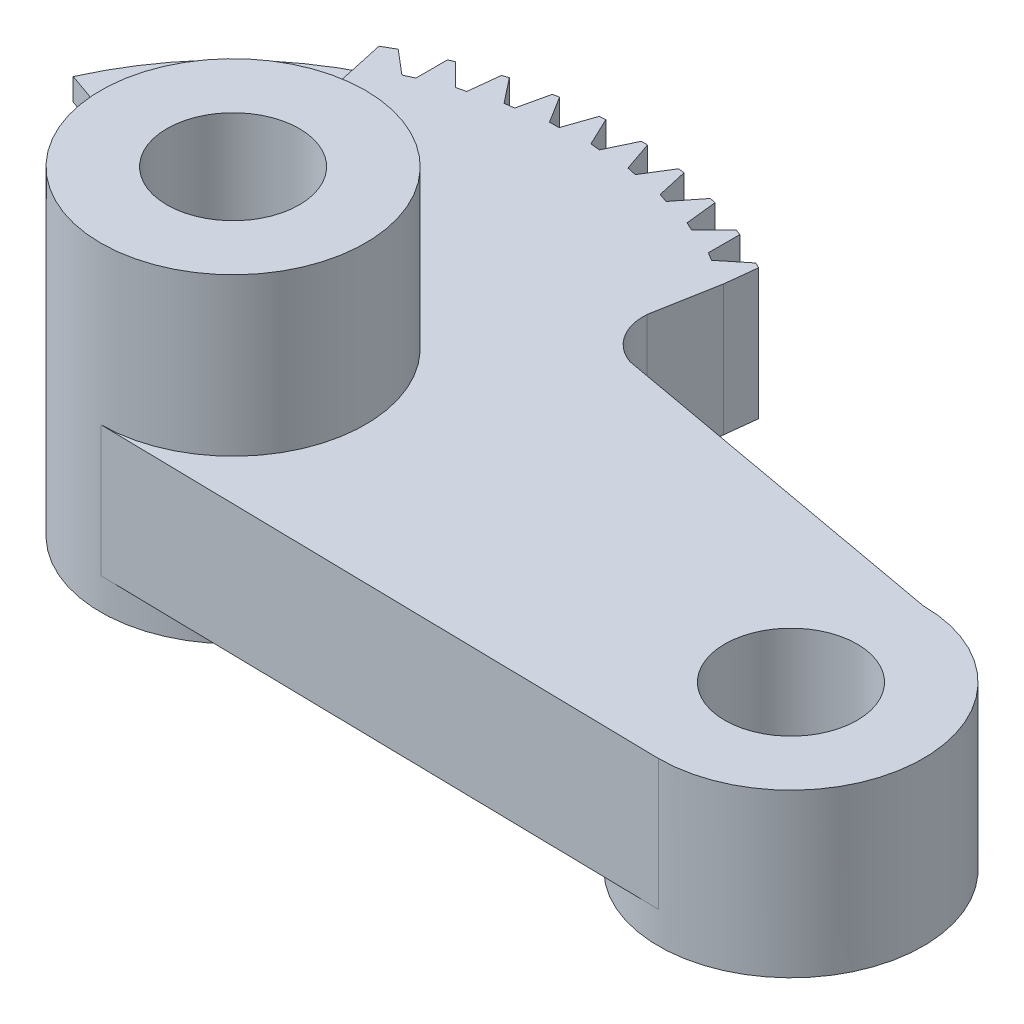
from build123d import *

# Parameters (mm, degrees)
SKETCH_1_R          = 2.5
EXTRUDE_1_DEPTH     = 4.94
SKETCH_2_R          = 5
SKETCH_2_R_2        = 2.5
EXTRUDE_2_DEPTH     = 5.94
CUT_EXTRUDE_1_DEPTH = 3.5
CUT_EXTRUDE_START   = -0.6
CUT_EXTRUDE_3_DEPTH = 0.6
EXTRUDE_START       = 1.2
SKETCH_6_R          = 5
SKETCH_6_R_2        = 2.5
EXTRUDE_4_DEPTH     = 1.2


with BuildPart() as part:
    # Эскиз1 → Бобышка-Вытянуть1 (new body)
    with BuildSketch(Plane(origin=(0, 0, 0), x_dir=(1, 0, 0), z_dir=(0, 1, 0))):
        with BuildLine():
            Line((6.718023265, 8.928267668), (7.161238337, 11.377850658))
            Line((7.161238337, 11.377850658), (7.294846289, 12.560700282))
            Line((7.294846289, 12.560700282), (7.085001061, 12.665407083))
            Line((7.085001061, 12.665407083), (6.159877925, 11.916319971))
            Line((6.159877925, 11.916319971), (5.853623131, 12.103836942))
            Line((5.853623131, 12.103836942), (5.855060736, 13.294207578))
            Line((5.855060736, 13.294207578), (5.634886529, 13.374965561))
            Line((5.634886529, 13.374965561), (4.798663389, 12.527784838))
            Line((4.798663389, 12.527784838), (4.473480547, 12.680135527))
            Line((4.473480547, 12.680135527), (4.342730025, 13.863304415))
            Line((4.342730025, 13.863304415), (4.114949999, 13.91911475))
            Line((4.114949999, 13.91911475), (3.377969444, 12.984318527))
            Line((3.377969444, 12.984318527), (3.037880485, 13.099618629))
            Line((3.037880485, 13.099618629), (2.776558986, 14.260952083))
            Line((2.776558986, 14.260952083), (2.543990375, 14.291124494))
            Line((2.543990375, 14.291124494), (1.915367537, 13.280274533))
            Line((1.915367537, 13.280274533), (1.564578755, 13.357097991))
            Line((1.564578755, 13.357097991), (1.17591836, 14.48223239))
            Line((1.17591836, 14.48223239), (0.941437621, 14.486393699))
            Line((0.941437621, 14.486393699), (0.428947442, 13.411992407))
            Line((0.428947442, 13.411992407), (0.071797468, 13.449389053))
            Line((0.071797468, 13.449389053), (-0.439394788, 14.524408492))
            Line((-0.439394788, 14.524408492), (-0.672887547, 14.502507231))
            Line((-0.672887547, 14.502507231), (-1.062906477, 13.377843036))
            Line((-1.062906477, 13.377843036), (-1.422000336, 13.375350339))
            Line((-1.422000336, 13.375350339), (-2.049401918, 14.386958748))
            Line((-2.049401918, 14.386958748), (-2.279018808, 14.339265797))
            Line((-2.279018808, 14.339265797), (-2.541742652, 13.178248786))
            Line((-2.541742652, 13.178248786), (-2.898339046, 13.135897577))
            Line((-2.898339046, 13.135897577), (-3.634190116, 14.071583165))
            Line((-3.634190116, 14.071583165), (-3.857091185, 13.9986884))
            Line((-3.857091185, 13.9986884), (-3.989270518, 12.815678281))
            Line((-3.989270518, 12.815678281), (-4.338958987, 12.733992368))
            Line((-4.338958987, 12.733992368), (-5.174158381, 13.582182376))
            Line((-5.174158381, 13.582182376), (-5.387586742, 13.484987375))
            Line((-5.387586742, 13.484987375), (-5.387586742, 12.294615871))
            Line((-5.387586742, 12.294615871), (-5.751610974, 12.128839703))
            Line((-5.751610974, 12.128839703), (-6.666748566, 12.905854249))
            Line((-6.666748566, 12.905854249), (-7.130964404, 12.639434725))
            Line((-7.130964404, 12.639434725), (-7.025830917, 12.175864107))
            ThreePointArc((-7.025830917, 12.175864107), (-10.264322646, 9.799709596), (-12.511112532, 6.470163958))
            Line((-12.511112532, 6.470163958), (-5.24107122, 3.924995297))
            Line((-5.24107122, 3.924995297), (-4.737733568, 1.598086557))
            ThreePointArc((-4.737733568, 1.598086557), (-4.061430338, -2.916296214), (0, -5))
            Line((0, -5), (21.466935896, -5.388260462))
            ThreePointArc((21.466935896, -5.388260462), (26.466935896, -0.388260462), (21.466935896, 4.611739538))
            Line((21.466935896, 4.611739538), (7.924308406, 7.062073596))
            ThreePointArc((7.924308406, 7.062073596), (7.004635762, 7.790569444), (6.718023265, 8.928267668))
        make_face()
        with Locations(Location((21.466935896, -0.388260462, 0), (0, 0, 270))):
            Circle(SKETCH_1_R, mode=Mode.SUBTRACT)
        with Locations(Location((0, 0, 0), (0, 0, 270))):
            Circle(SKETCH_1_R, mode=Mode.SUBTRACT)
    extrude(amount=EXTRUDE_1_DEPTH)

    # Эскиз2 → Бобышка-Вытянуть2 (add)
    with BuildSketch(Plane(origin=(0, 4.94, 0), x_dir=(1, 0, 0), z_dir=(0, 1, 0))):
        with Locations(Location((0, 0, 0), (0, 0, 270))):
            Circle(SKETCH_2_R)
        with Locations(Location((0, 0, 0), (0, 0, 270))):
            Circle(SKETCH_2_R_2, mode=Mode.SUBTRACT)
    extrude(amount=EXTRUDE_2_DEPTH)

    # Эскиз4 → Вырез-Вытянуть1 (cut)
    with BuildSketch(Plane.XZ):
        with BuildLine():
            Line((-5.24107122, -3.924995297), (-7.025830917, -12.175864107))
            ThreePointArc((-7.025830917, -12.175864107), (-10.264322646, -9.799709596), (-12.511112532, -6.470163958))
            Line((-12.511112532, -6.470163958), (-5.24107122, -3.924995297))
        make_face()
    extrude(amount=-CUT_EXTRUDE_1_DEPTH, mode=Mode.SUBTRACT)

    # Эскиз5 → Вырез-Вытянуть3 (cut)
    with BuildSketch(Plane(origin=(0, 4.94, 0), x_dir=(1, 0, 0), z_dir=(0, 1, 0)).offset(CUT_EXTRUDE_START)):
        with BuildLine():
            Line((-5.24107122, 3.924995297), (-7.025830917, 12.175864107))
            ThreePointArc((-7.025830917, 12.175864107), (-10.264322646, 9.799709596), (-12.511112532, 6.470163958))
            Line((-12.511112532, 6.470163958), (-5.24107122, 3.924995297))
        make_face()
    extrude(amount=CUT_EXTRUDE_3_DEPTH, mode=Mode.SUBTRACT)

    # Эскиз6 → Бобышка-Вытянуть4 (add)
    # profile 1 of 2: a face of its own
    with BuildSketch(Plane.XZ.offset(EXTRUDE_START)):
        with Locations(Location((0, 0, 0), (0, 0, 270))):
            Circle(SKETCH_6_R)
        with Locations(Location((0, 0, 0), (0, 0, 270))):
            Circle(SKETCH_6_R_2, mode=Mode.SUBTRACT)
    # profile 2 of 2: a face of its own
    with BuildSketch(Plane.XZ.offset(EXTRUDE_START)):
        with Locations(Location((21.466935896, 0.388260462, 0), (0, 0, 270))):
            Circle(SKETCH_6_R)
        with Locations(Location((21.466935896, 0.388260462, 0), (0, 0, 270))):
            Circle(SKETCH_6_R_2, mode=Mode.SUBTRACT)
    extrude(amount=-EXTRUDE_4_DEPTH)


solid = part.part
